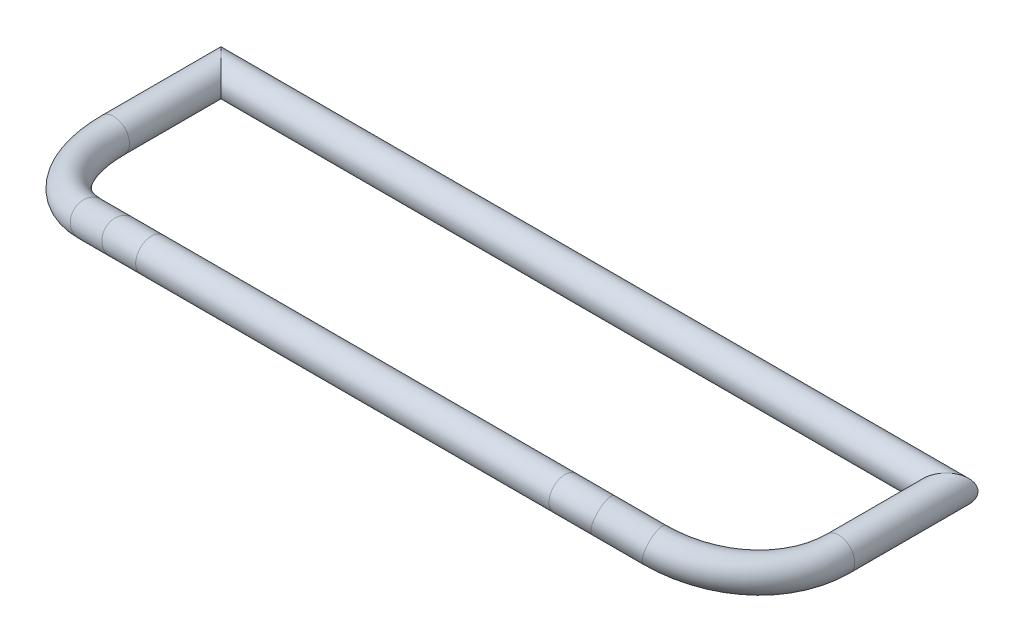
from build123d import *

# Parameters (mm, degrees)
BARRER1_PROFILE_R = 15


with BuildPart() as part:
    # Barrer1: sweep along a curve in space
    with BuildLine() as barrer1_path:
        Line((264.918926477, 18.063618937, 18.063618937), (226.035142661, 27.418597771, 27.418597771))
        ThreePointArc((226.035142661, 27.418597771, 27.418597771), (210.148674123, 30.238757749, 30.238757749), (193.824243162, 31.187293721, 31.187293721))
        Line((193.824243162, 31.187293721, 31.187293721), (-193.824243162, 31.187293721, 31.187293721))
        ThreePointArc((-193.824243162, 31.187293721, 31.187293721), (-210.148674123, 30.238757749, 30.238757749), (-226.035142661, 27.418597771, 27.418597771))
        Line((-264.918926477, 18.063618937, 18.063618937), (-226.035142661, 27.418597771, 27.418597771))
        ThreePointArc((-264.918926477, 18.063618937, 18.063618937), (-318.95127781, 5.064073793, -17.169648176), (-340, 0, -79.30798358))
        Line((-340, 0, -79.30798358), (-340, 0, -180))
        Line((-340, 0, -180), (340, 0, -180))
        Line((340, 0, -79.30798358), (340, 0, -180))
        ThreePointArc((264.918926477, 18.063618937, 18.063618937), (318.95127781, 5.064073793, -17.169648176), (340, 0, -79.30798358))
    # Barrer1 profile (on start of the path) → Barrer1 (sweep)
    with BuildSketch(Plane(origin=(264.918926477, 18.063618937, 18.063618937), x_dir=(-0.23391363473017787, 0, -0.9722573792403516), z_dir=(-0.9467025907554608, 0.22776545464237832, 0.22776545464237832))):
        Circle(BARRER1_PROFILE_R)
    sweep(path=barrer1_path.line, transition=Transition.RIGHT)


solid = part.part
